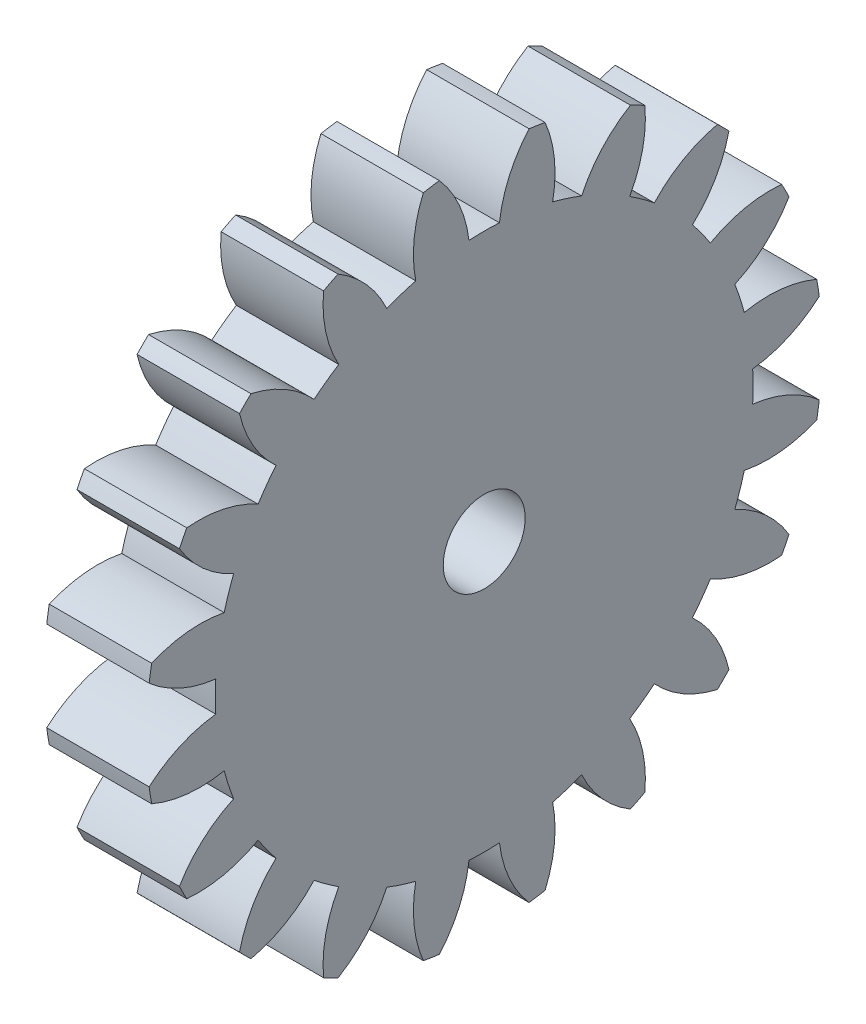
from build123d import *

# Parameters (mm, degrees)
BASPROSKE_W     = 5
BASPROSKE_H     = 16.5
TOOTHCUT_DEPTH  = 24.864199128
TEETHCUTS_COUNT = 20
TEETHCUTS_ANGLE = 342
BORSKE_R        = 2
BORE_DEPTH      = 50.0000508


with BuildPart() as part:
    # BasProSke → Base-Revolve (revolve)
    with BuildSketch(Plane(origin=(0, 0, 0), x_dir=(1, 0, 0), z_dir=(0, 1, 0)), mode=Mode.PRIVATE) as base_revolve_sk:
        with Locations((2.5, 8.25)):
            Rectangle(BASPROSKE_W, BASPROSKE_H)
    revolve(base_revolve_sk.sketch.rotate(Axis((-10, 0, 0), (1, 0, 0)), 180), axis=Axis((-10, 0, 0), (1, 0, 0)))

    # TooCutSke → ToothCut (cut, through all)
    with BuildSketch(Plane(origin=(0, 0, 0), x_dir=(0, 0, -1), z_dir=(1, 0, 0))):
        with BuildLine():
            ThreePointArc((0.74381438, 13.102904875), (0, 13.124), (-0.74381438, 13.102904875))
            ThreePointArc((-0.74381438, 13.102904875), (-1.226473103, 14.852072512), (-2.209965745, 16.376962373))
            ThreePointArc((-2.209965745, 16.376962373), (0, 16.5254), (2.209965745, 16.376962373))
            ThreePointArc((2.209965745, 16.376962373), (1.226473103, 14.852072512), (0.74381438, 13.102904875))
        make_face()
    toothcut = extrude(amount=TOOTHCUT_DEPTH, mode=Mode.SUBTRACT)

    # TeethCuts: ToothCut ×20 about axis
    teethcuts_axis = Axis((-10, 0, 0), (1, 0, 0))
    for i in range(1, TEETHCUTS_COUNT):
        add(toothcut.rotate(teethcuts_axis, i * TEETHCUTS_ANGLE / (TEETHCUTS_COUNT - 1)), mode=Mode.SUBTRACT)

    # BorSke → Bore (cut, symmetric)
    with BuildSketch(Plane(origin=(0, 0, 0), x_dir=(0, 0, -1), z_dir=(1, 0, 0))):
        with Locations(Location((0, 0, 0), (0, 0, 180))):
            Circle(BORSKE_R)
    extrude(amount=BORE_DEPTH, both=True, mode=Mode.SUBTRACT)


solid = part.part
